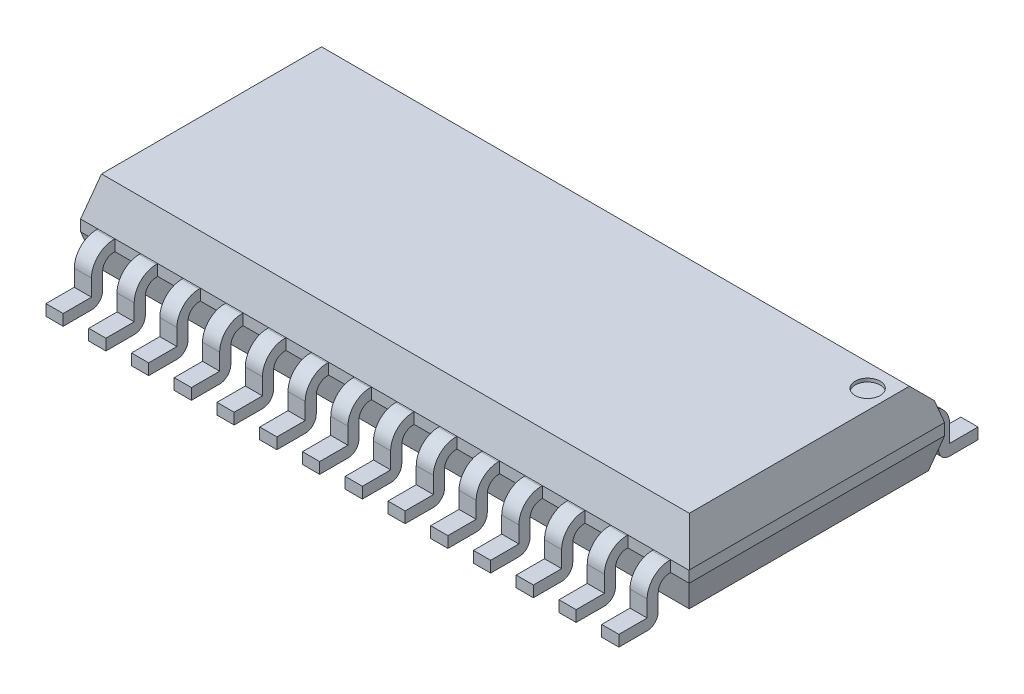
from build123d import *

# Parameters (mm, degrees)
EXTRUDE1_DEPTH     = 18.08
CHAMFER1_SIZE      = 1.15
CHAMFER1_SIZE2     = 0.308141571
CHAMFER2_SIZE      = 0.9
CHAMFER2_SIZE2     = 0.241154273
CHAMFER3_SIZE      = 0.9
CHAMFER3_SIZE2     = 0.241154273
CHAMFER4_SIZE      = 1.15
CHAMFER4_SIZE2     = 0.308141571
SKETCH2_W          = 0.51
SKETCH2_H          = 0.33
SKETCH4_R          = 0.371208756
CUT_EXTRUDE1_DEPTH = 0.1


with BuildPart() as part:
    # Sketch1 → Extrude1 (new body)
    with BuildSketch(Plane(origin=(0, 0, 0), x_dir=(0, 0, -1), z_dir=(1, 0, 0))):
        Polygon((0.241154273, 0), (7.348845727, 0), (7.59, 0.9), (7.59, 1.23), (7.43626933, 1.80373067), (6.85, 2.39), (0.310821063, 2.39), (0, 1.23), (0, 0.9), align=None)
    extrude(amount=EXTRUDE1_DEPTH)

    # Chamfer1
    chamfer1_edges = [part.edges().sort_by_distance(p)[0] for p in [
        (18.08, 2.39, -3.580410532),
    ]]
    chamfer1_side = [part.faces().sort_by_distance(p)[0] for p in [
        (18.08, 1.182213707, -3.770515745),
    ]]
    chamfer(chamfer1_edges, length=CHAMFER1_SIZE, length2=CHAMFER1_SIZE2, reference=chamfer1_side[0])

    # Chamfer2
    chamfer2_edges = [part.edges().sort_by_distance(p)[0] for p in [
        (18.08, 0, -3.795),
    ]]
    chamfer2_side = [part.faces().sort_by_distance(p)[0] for p in [
        (18.08, 0.627551868, -3.795),
    ]]
    chamfer(chamfer2_edges, length=CHAMFER2_SIZE, length2=CHAMFER2_SIZE2, reference=chamfer2_side[0])

    # Chamfer3
    chamfer3_edges = [part.edges().sort_by_distance(p)[0] for p in [
        (0, 0, -3.795),
    ]]
    chamfer3_side = [part.faces().sort_by_distance(p)[0] for p in [
        (0, 1.182213707, -3.770515745),
    ]]
    chamfer(chamfer3_edges, length=CHAMFER3_SIZE, length2=CHAMFER3_SIZE2, reference=chamfer3_side[0])

    # Chamfer4
    chamfer4_edges = [part.edges().sort_by_distance(p)[0] for p in [
        (0, 2.39, -3.580410532),
    ]]
    chamfer4_side = [part.faces().sort_by_distance(p)[0] for p in [
        (0, 1.626673893, -3.755552999),
    ]]
    chamfer(chamfer4_edges, length=CHAMFER4_SIZE, length2=CHAMFER4_SIZE2, reference=chamfer4_side[0])

    # Sweep1: sweep along a path in Sketch3
    with BuildLine(Plane.ZY) as sweep1_path:
        Line((-7.59, 0.9), (-7.63, 0.9))
        ThreePointArc((-7.63, 0.9), (-7.863345238, 0.803345238), (-7.96, 0.57))
        Line((-7.96, 0.57), (-7.96, 0.08))
        ThreePointArc((-7.96, 0.08), (-8.056654762, -0.153345238), (-8.29, -0.25))
        Line((-8.29, -0.25), (-9.13, -0.25))
    # Sketch2 → Sweep1 (sweep)
    with BuildSketch(Plane(origin=(0, 0, -7.59), x_dir=(-1, 0, 0), z_dir=(0, 0, -1))):
        with Locations((-17.275, 1.065)):
            Rectangle(SKETCH2_W, SKETCH2_H)
        with Locations((-16.005, 1.065)):
            Rectangle(SKETCH2_W, SKETCH2_H)
        with Locations((-14.735, 1.065)):
            Rectangle(SKETCH2_W, SKETCH2_H)
        with Locations((-13.465, 1.065)):
            Rectangle(SKETCH2_W, SKETCH2_H)
        with Locations((-12.195, 1.065)):
            Rectangle(SKETCH2_W, SKETCH2_H)
        with Locations((-10.925, 1.065)):
            Rectangle(SKETCH2_W, SKETCH2_H)
        with Locations((-9.655, 1.065)):
            Rectangle(SKETCH2_W, SKETCH2_H)
        with Locations((-8.385, 1.065)):
            Rectangle(SKETCH2_W, SKETCH2_H)
        with Locations((-7.115, 1.065)):
            Rectangle(SKETCH2_W, SKETCH2_H)
        with Locations((-5.845, 1.065)):
            Rectangle(SKETCH2_W, SKETCH2_H)
        with Locations((-4.575, 1.065)):
            Rectangle(SKETCH2_W, SKETCH2_H)
        with Locations((-3.305, 1.065)):
            Rectangle(SKETCH2_W, SKETCH2_H)
        with Locations((-2.035, 1.065)):
            Rectangle(SKETCH2_W, SKETCH2_H)
        with Locations((-0.765, 1.065)):
            Rectangle(SKETCH2_W, SKETCH2_H)
    sweep1 = sweep(path=sweep1_path.line)

    # Mirror1: Sweep1 across plane
    add(sweep1.mirror(Plane.XY.offset(-3.795)))

    # Sketch4 → Cut-Extrude1 (cut)
    with BuildSketch(Plane(origin=(0, 2.39, 0), x_dir=(1, 0, 0), z_dir=(0, 1, 0))):
        with Locations(Location((17.206592633, 6.1751032, 0), (0, 0, 270))):
            Circle(SKETCH4_R)
    extrude(amount=-CUT_EXTRUDE1_DEPTH, mode=Mode.SUBTRACT)


solid = part.part
